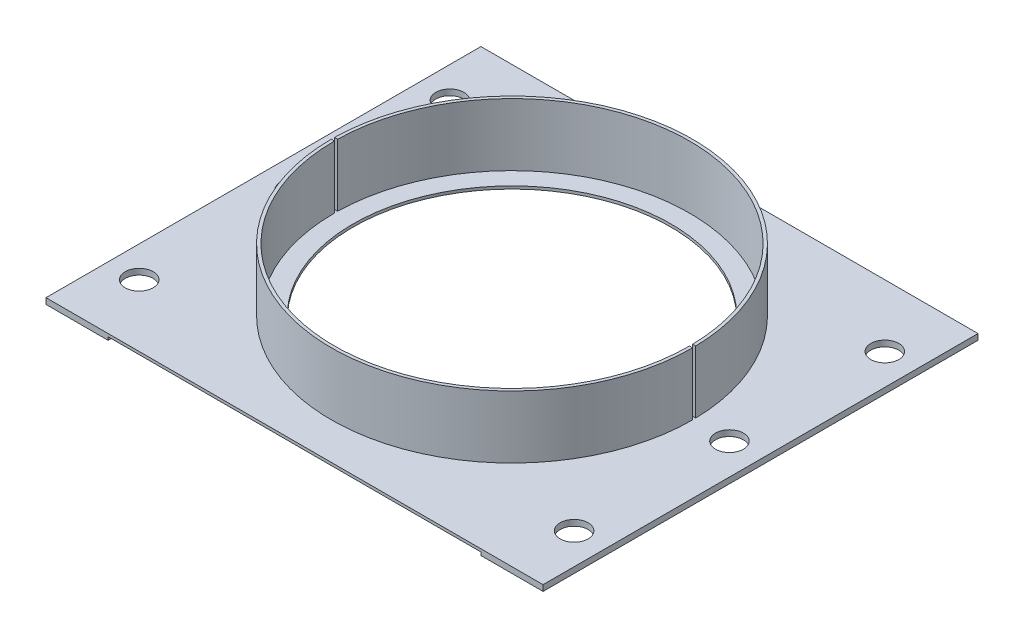
from build123d import *

# Parameters (mm, degrees)
CROQUIS1_W                       = 160
CROQUIS1_H                       = 140
CROQUIS1_R                       = 51.15
SALIENTE_EXTRUIR1_DEPTH          = 0.9
CROQUIS4_W                       = 20
CROQUIS4_H                       = 140
SALIENTE_EXTRUIR3_DEPTH          = 1
TALADRO_DE_MARGEN_PARA_M81_D     = 9
TALADRO_DE_MARGEN_PARA_M81_DEPTH = 10
TALADRO_DE_MARGEN_PARA_M81_TIP   = 2.703872786
SALIENTE_EXTRUIR4_DEPTH          = 21


with BuildPart() as part:
    # Croquis1 → Saliente-Extruir1 (new body)
    with BuildSketch(Plane(origin=(0, 0, 0), x_dir=(1, 0, 0), z_dir=(0, 1, 0))):
        Rectangle(CROQUIS1_W, CROQUIS1_H)
        with Locations(Location((0, 0, 0), (0, 0, 270))):
            Circle(CROQUIS1_R, mode=Mode.SUBTRACT)
    extrude(amount=SALIENTE_EXTRUIR1_DEPTH)

    # Croquis4 → Saliente-Extruir3 (add)
    with BuildSketch(Plane.XZ):
        with Locations((70, 0)):
            Rectangle(CROQUIS4_W, CROQUIS4_H)
        with Locations((-70, 0)):
            Rectangle(CROQUIS4_W, CROQUIS4_H)
    extrude(amount=SALIENTE_EXTRUIR3_DEPTH)

    # Taladro de margen para M81
    with Locations(Plane(origin=(-70, 0.9, -50), x_dir=(0, 0, 1), z_dir=(0, 1, 0))):
        with Locations((0, 0), (50, 0), (100, 0), (100, 140), (50, 140), (0, 140)):
            Hole(TALADRO_DE_MARGEN_PARA_M81_D / 2, depth=TALADRO_DE_MARGEN_PARA_M81_DEPTH)
            with Locations((0, 0, -(TALADRO_DE_MARGEN_PARA_M81_DEPTH + TALADRO_DE_MARGEN_PARA_M81_TIP / 2))):  # 118° drill point
                Cone(0, TALADRO_DE_MARGEN_PARA_M81_D / 2, TALADRO_DE_MARGEN_PARA_M81_TIP, mode=Mode.SUBTRACT)

    # Croquis5 → Saliente-Extruir4 (add)
    with BuildSketch(Plane.XZ):
        with BuildLine():
            ThreePointArc((57.15, 0), (0, 57.15), (-57.15, 0))
            Line((-57.15, 0), (-58.15, 0))
            ThreePointArc((-58.15, 0), (0, 58.15), (58.15, 0))
            Line((58.15, 0), (57.15, 0))
        make_face()
        with BuildLine():
            ThreePointArc((-58.141400912, -1), (0, -58.15), (58.141400912, -1))
            Line((58.141400912, -1), (57.141250424, -1))
            ThreePointArc((57.141250424, -1), (0, -57.15), (-57.141250424, -1))
            Line((-57.141250424, -1), (-58.141400912, -1))
        make_face()
    extrude(amount=-SALIENTE_EXTRUIR4_DEPTH)


solid = part.part
